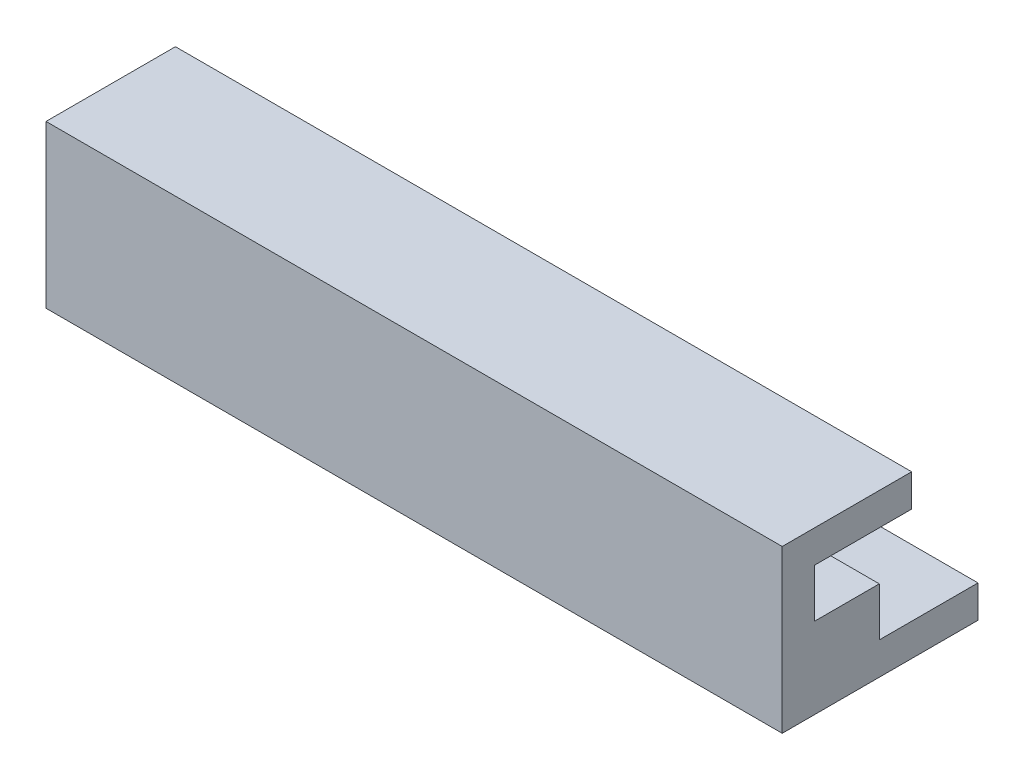
from build123d import *

# Parameters (mm, degrees)
SALIENTE_EXTRUIR1_DEPTH = 2
SALIENTE_EXTRUIR2_DEPTH = 24
CROQUIS4_W              = 26.838471133
CROQUIS4_H              = 17.040828642
CORTAR_EXTRUIR1_DEPTH   = 70.1
SALIENTE_EXTRUIR3_DEPTH = 2
SALIENTE_EXTRUIR4_DEPTH = 2
CROQUIS7_W              = 45.5
CROQUIS7_H              = 2
SALIENTE_EXTRUIR5_DEPTH = 8
SALIENTE_EXTRUIR6_DEPTH = 6
CROQUIS9_W              = 76.962380363
CROQUIS9_H              = 58.957858246
CORTAR_EXTRUIR2_DEPTH   = 39


with BuildPart() as part:
    # Croquis1 → Saliente-Extruir1 (new body)
    with BuildSketch(Plane.XY):
        Polygon((-48.939551095, 26.503456625), (-8.439551095, 26.503456625), (-4.439551095, 26.503456625), (-4.439551095, 1.503456625), (-8.439551095, 1.503456625), (-49.939551095, 1.503456625), (-49.939551095, 5.503456625), (-49.939551095, 26.503456625), align=None)
    extrude(amount=SALIENTE_EXTRUIR1_DEPTH)

    # Croquis3 → Saliente-Extruir2 (add)
    with BuildSketch(Plane.XY):
        Polygon((-48.939551095, 26.503456625), (-8.439551095, 26.503456625), (-4.439551095, 26.503456625), (-4.439551095, 1.503456625), (-49.939551095, 1.503456625), (-49.939551095, 26.503456625), align=None)
        Polygon((-10.439551095, 3.503456625), (-47.939551095, 3.503456625), (-47.939551095, 5.503456625), (-47.939551095, 24.503456625), (-10.439551095, 24.503456625), (-6.439551095, 24.503456625), (-6.439551095, 3.503456625), align=None, mode=Mode.SUBTRACT)
    extrude(amount=SALIENTE_EXTRUIR2_DEPTH)

    # Croquis4 → Cortar-Extruir1 (cut)
    with BuildSketch(Plane(origin=(0, 0, 0), x_dir=(0, 0, -1), z_dir=(1, 0, 0))):
        with Locations((-15.419235567, 13.92807924)):
            Rectangle(CROQUIS4_W, CROQUIS4_H)
    extrude(amount=-CORTAR_EXTRUIR1_DEPTH, mode=Mode.SUBTRACT)

    # Croquis5 → Saliente-Extruir3 (add)
    with BuildSketch(Plane(origin=(0, 26.503456625, 0), x_dir=(1, 0, 0), z_dir=(0, 1, 0))):
        Polygon((-49.939551095, -20.607192887), (-4.439551095, -20.607192887), (-4.439551095, -36.1), (-8.439551095, -36.1), (-48.939551095, -36.1), (-49.939551095, -36.1), align=None)
    extrude(amount=-SALIENTE_EXTRUIR3_DEPTH)

    # Croquis6 → Saliente-Extruir4 (add)
    with BuildSketch(Plane.XY.offset(36.1)):
        Polygon((-4.439551095, 24.503456625), (-49.939551095, 24.503456625), (-49.939551095, 33.503456625), (-49.939551095, 34.503456625), (-4.439551095, 34.503456625), (-4.439551095, 33.503456625), align=None)
    extrude(amount=-SALIENTE_EXTRUIR4_DEPTH)

    # Croquis7 → Saliente-Extruir5 (add)
    with BuildSketch(Plane.XY.offset(36.1)):
        with Locations((-27.189551095, 33.503456625)):
            Rectangle(CROQUIS7_W, CROQUIS7_H)
    extrude(amount=-SALIENTE_EXTRUIR5_DEPTH)

    # Croquis8 → Saliente-Extruir6 (add)
    with BuildSketch(Plane.XY.offset(36.1)):
        Polygon((-49.939551095, 29.503456625), (-49.939551095, 26.503456625), (-49.715027183, 26.503456625), (-8.439551095, 26.503456625), (-4.439551095, 26.503456625), (-4.439551095, 29.503456625), (-8.439551095, 29.503456625), (-49.715027183, 29.503456625), align=None)
    extrude(amount=-SALIENTE_EXTRUIR6_DEPTH)

    # Croquis9 → Cortar-Extruir2 (cut)
    with BuildSketch(Plane.XY.offset(24)):
        with Locations((-25.38769132, 23.863692023)):
            Rectangle(CROQUIS9_W, CROQUIS9_H)
    extrude(amount=-CORTAR_EXTRUIR2_DEPTH, mode=Mode.SUBTRACT)


solid = part.part
